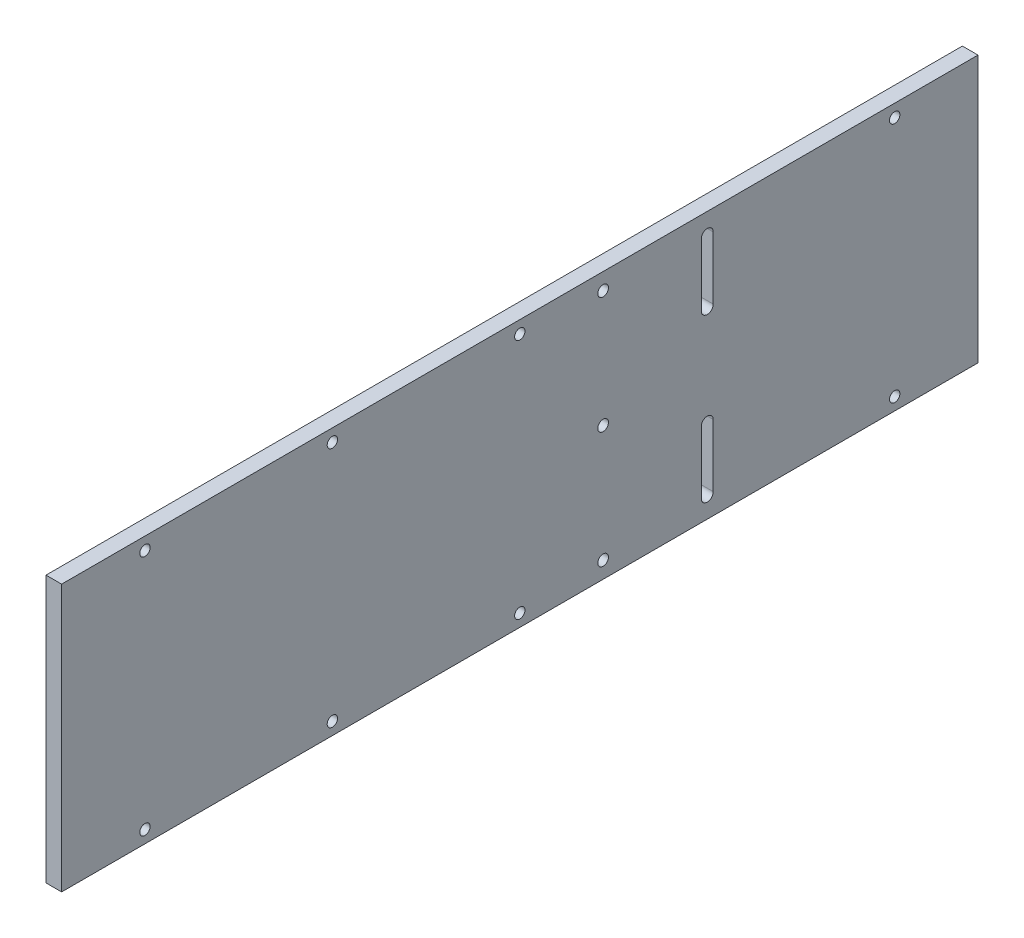
from build123d import *

# Parameters (mm, degrees)
SKETCH1_W                     = 279.4
SKETCH1_H                     = 81.28
BOSS_EXTRUDE1_DEPTH           = 4.7625
SKETCH2_R                     = 4.7625
GEARBOX_WITH_PRESS_FITS_DEPTH = 316.363404917
SKETCH3_R                     = 1.58115
CUT_EXTRUDE1_DEPTH            = 316.363404917
F_4_CLEARANCE_HOLE1_D         = 3.2639
F_4_CLEARANCE_HOLE1_DEPTH     = 4.826
F_4_CLEARANCE_HOLE1_TIP       = 0.980574487


with BuildPart() as part:
    # Sketch1 → Boss-Extrude1 (new body)
    with BuildSketch(Plane(origin=(0, 0, 0), x_dir=(0, 0, -1), z_dir=(1, 0, 0))):
        with Locations((172.997595377, 0)):
            Rectangle(SKETCH1_W, SKETCH1_H)
    extrude(amount=BOSS_EXTRUDE1_DEPTH)

    # Sketch2 → Gearbox (with Press fits) (cut, through all)
    with BuildSketch(Plane(origin=(4.7625, 0, 0), x_dir=(0, 0, -1), z_dir=(1, 0, 0))):
        with Locations((331.004197306, 10)):
            Circle(SKETCH2_R)
    extrude(amount=-GEARBOX_WITH_PRESS_FITS_DEPTH, mode=Mode.SUBTRACT)

    # Sketch3 → Cut-Extrude1 (cut, through all)
    with BuildSketch(Plane(origin=(4.7625, 0, 0), x_dir=(0, 0, -1), z_dir=(1, 0, 0))):
        with Locations((287.297595377, 36.83)):
            Circle(SKETCH3_R)
        with Locations((172.997595377, 36.83)):
            Circle(SKETCH3_R)
        with Locations((115.847595377, 36.83)):
            Circle(SKETCH3_R)
        with Locations((58.697595377, 36.83)):
            Circle(SKETCH3_R)
        with Locations((58.697595377, -36.83)):
            Circle(SKETCH3_R)
        with Locations((115.847595377, -36.83)):
            Circle(SKETCH3_R)
        with Locations((172.997595377, -36.83)):
            Circle(SKETCH3_R)
        with Locations((287.297595377, -36.83)):
            Circle(SKETCH3_R)
        with BuildLine():
            Line((231.976395377, 34.29), (231.976395377, 15.24))
            ThreePointArc((231.976395377, 15.24), (230.147595377, 13.4112), (228.318795377, 15.24))
            Line((228.318795377, 15.24), (228.318795377, 34.29))
            ThreePointArc((228.318795377, 34.29), (230.147595377, 36.1188), (231.976395377, 34.29))
        make_face()
        with BuildLine():
            Line((231.976395377, -34.29), (231.976395377, -15.24))
            ThreePointArc((231.976395377, -15.24), (230.147595377, -13.4112), (228.318795377, -15.24))
            Line((228.318795377, -15.24), (228.318795377, -34.29))
            ThreePointArc((228.318795377, -34.29), (230.147595377, -36.1188), (231.976395377, -34.29))
        make_face()
    extrude(amount=-CUT_EXTRUDE1_DEPTH, mode=Mode.SUBTRACT)

    # #4 Clearance Hole1
    with Locations(Plane(origin=(4.7625, 0, 0), x_dir=(0, 0, -1), z_dir=(1, 0, 0))):
        with Locations((198.397595377, 35.56), (198.397595377, -35.56), (198.397595377, 0)):
            Hole(F_4_CLEARANCE_HOLE1_D / 2, depth=F_4_CLEARANCE_HOLE1_DEPTH)
            with Locations((0, 0, -(F_4_CLEARANCE_HOLE1_DEPTH + F_4_CLEARANCE_HOLE1_TIP / 2))):  # 118° drill point
                Cone(0, F_4_CLEARANCE_HOLE1_D / 2, F_4_CLEARANCE_HOLE1_TIP, mode=Mode.SUBTRACT)


solid = part.part
